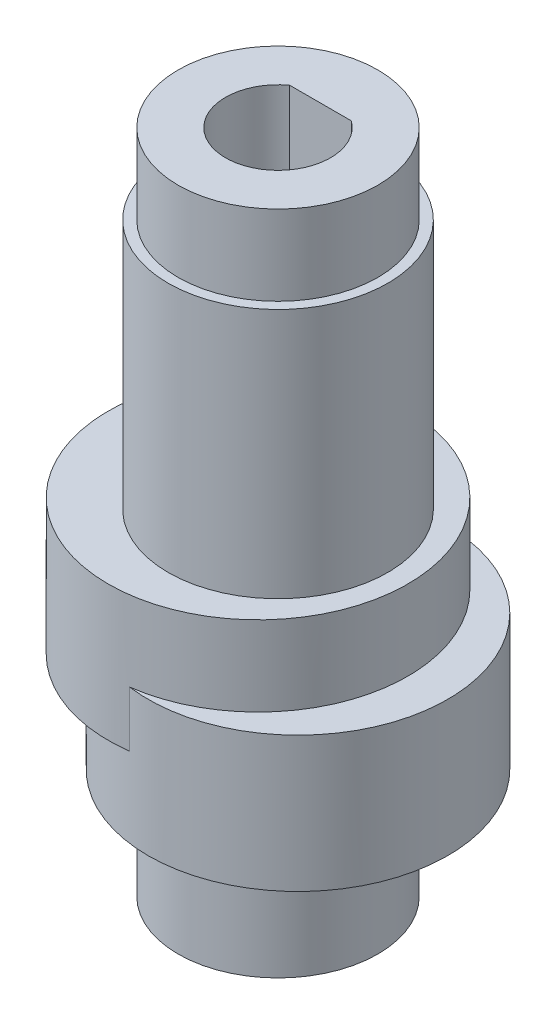
from build123d import *

# Parameters (mm, degrees)
SKETCH1_R            = 7.5
BOSS_EXTRUDE1_DEPTH  = 6.779166667
BOSS_EXTRUDE2_DEPTH  = 2.779166667
BOSS_EXTRUDE3_START  = -4
SKETCH1_4_R          = 7.5
BOSS_EXTRUDE3_DEPTH  = 4
BOSS_EXTRUDE4_START  = 6.016666667
SKETCH2_R            = 5
BOSS_EXTRUDE4_DEPTH  = 6.016666667
BOSS_EXTRUDE5_START  = 1.254166667
SKETCH2_3_R          = 5.5
SKETCH2_3_R_2        = 5
BOSS_EXTRUDE5_DEPTH  = 1.254166667
SKETCH3_R            = 5
BOSS_EXTRUDE9_DEPTH  = 16.541666667
SKETCH3_3_R          = 5.5
SKETCH3_3_R_2        = 5
BOSS_EXTRUDE10_DEPTH = 12.541666667


with BuildPart() as part:
    # Sketch1 → Boss-Extrude1 (new body)
    with BuildSketch(Plane(origin=(0, 0, 0), x_dir=(1, 0, 0), z_dir=(0, 1, 0))):
        with Locations(Location((-1, 0, 0), (0, 0, 270))):
            Circle(SKETCH1_R)
        with BuildLine():
            Line((-1.54175225, 2.127), (1.54175225, 2.127))
            ThreePointArc((1.54175225, 2.127), (0, -2.627), (-1.54175225, 2.127))
        make_face(mode=Mode.SUBTRACT)
    extrude(amount=BOSS_EXTRUDE1_DEPTH)

    # Sketch1<3> → Boss-Extrude2 (add)
    with BuildSketch(Plane(origin=(0, 0, 0), x_dir=(1, 0, 0), z_dir=(0, 1, 0))):
        with BuildLine():
            ThreePointArc((0, -7.433034374), (5.937104415, -5.645794895), (8.5, 0))
            ThreePointArc((8.5, 0), (5.937104415, 5.645794895), (0, 7.433034374))
            ThreePointArc((0, 7.433034374), (4.645794895, 4.937104415), (6.5, 0))
            ThreePointArc((6.5, 0), (4.645794895, -4.937104415), (0, -7.433034374))
        make_face()
    extrude(amount=BOSS_EXTRUDE2_DEPTH)

    # Sketch1<4> → Boss-Extrude3 (add)
    with BuildSketch(Plane(origin=(0, 0, 0), x_dir=(1, 0, 0), z_dir=(0, 1, 0)).offset(BOSS_EXTRUDE3_START)):
        with Locations(Location((1, 0, 0), (0, 0, 97.662255661))):
            Circle(SKETCH1_4_R)
        with BuildLine():
            Line((-1.54175225, 2.127), (1.54175225, 2.127))
            ThreePointArc((1.54175225, 2.127), (0, -2.627), (-1.54175225, 2.127))
        make_face(mode=Mode.SUBTRACT)
    extrude(amount=BOSS_EXTRUDE3_DEPTH)

    # Sketch2 → Boss-Extrude4 (add)
    with BuildSketch(Plane.XZ.offset(4).offset(BOSS_EXTRUDE4_START)):
        with Locations(Location((0, 0, 0), (0, 0, 90))):
            Circle(SKETCH2_R)
        with BuildLine():
            ThreePointArc((-1.54175225, -2.127), (0, 2.627), (1.54175225, -2.127))
            Line((1.54175225, -2.127), (-1.54175225, -2.127))
        make_face(mode=Mode.SUBTRACT)
    extrude(amount=-BOSS_EXTRUDE4_DEPTH)

    # Sketch2<3> → Boss-Extrude5 (add)
    with BuildSketch(Plane.XZ.offset(4).offset(BOSS_EXTRUDE5_START)):
        with Locations(Location((0, 0, 0), (0, 0, 90))):
            Circle(SKETCH2_3_R)
        with Locations(Location((0, 0, 0), (0, 0, 270))):
            Circle(SKETCH2_3_R_2, mode=Mode.SUBTRACT)
    extrude(amount=-BOSS_EXTRUDE5_DEPTH)

    # Sketch3 → Boss-Extrude9 (add)
    with BuildSketch(Plane(origin=(0, 6.779166667, 0), x_dir=(1, 0, 0), z_dir=(0, 1, 0))):
        with Locations(Location((0, 0, 0), (0, 0, 90))):
            Circle(SKETCH3_R)
        with BuildLine():
            Line((-1.54175225, 2.127), (1.54175225, 2.127))
            ThreePointArc((1.54175225, 2.127), (0, -2.627), (-1.54175225, 2.127))
        make_face(mode=Mode.SUBTRACT)
    extrude(amount=BOSS_EXTRUDE9_DEPTH)

    # Sketch3<3> → Boss-Extrude10 (add)
    with BuildSketch(Plane(origin=(0, 6.779166667, 0), x_dir=(1, 0, 0), z_dir=(0, 1, 0))):
        with Locations(Location((0, 0, 0), (0, 0, 270))):
            Circle(SKETCH3_3_R)
        with Locations(Location((0, 0, 0), (0, 0, 90))):
            Circle(SKETCH3_3_R_2, mode=Mode.SUBTRACT)
    extrude(amount=BOSS_EXTRUDE10_DEPTH)


solid = part.part
